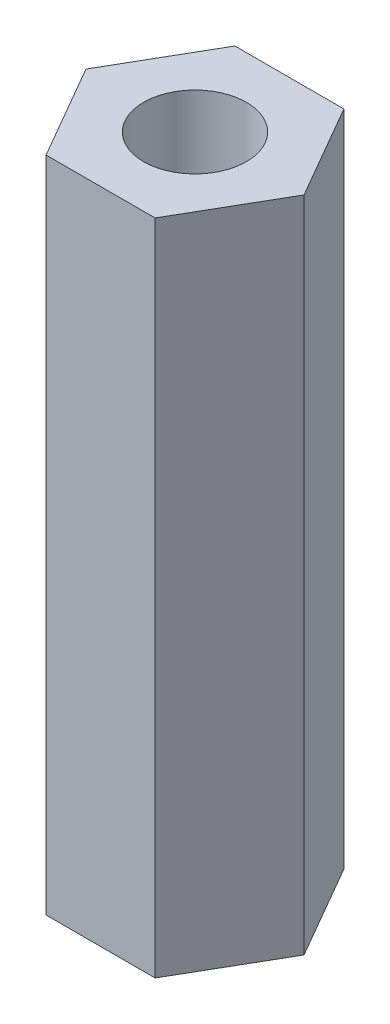
from build123d import *

# Parameters (mm, degrees)
EXTRUDE_1_DEPTH     = 16
SKETCH_7_R          = 1.25
CUT_EXTRUDE_1_DEPTH = 40


with BuildPart() as part:
    # 草图4 → 凸台-拉伸1 (new body)
    with BuildSketch(Plane(origin=(0, 0, 0), x_dir=(1, 0, 0), z_dir=(0, 1, 0))):
        Polygon((1.325, -2.29496732), (2.65, 0), (1.325, 2.29496732), (-1.325, 2.29496732), (-2.65, 0), (-1.325, -2.29496732), align=None)
    extrude(amount=EXTRUDE_1_DEPTH)

    # 草图7 → 切除-拉伸1 (cut)
    with BuildSketch(Plane(origin=(0, 16, 0), x_dir=(1, 0, 0), z_dir=(0, 1, 0))):
        with Locations(Location((0, 0, 0), (0, 0, 270))):
            Circle(SKETCH_7_R)
    extrude(amount=-CUT_EXTRUDE_1_DEPTH, mode=Mode.SUBTRACT)


solid = part.part
